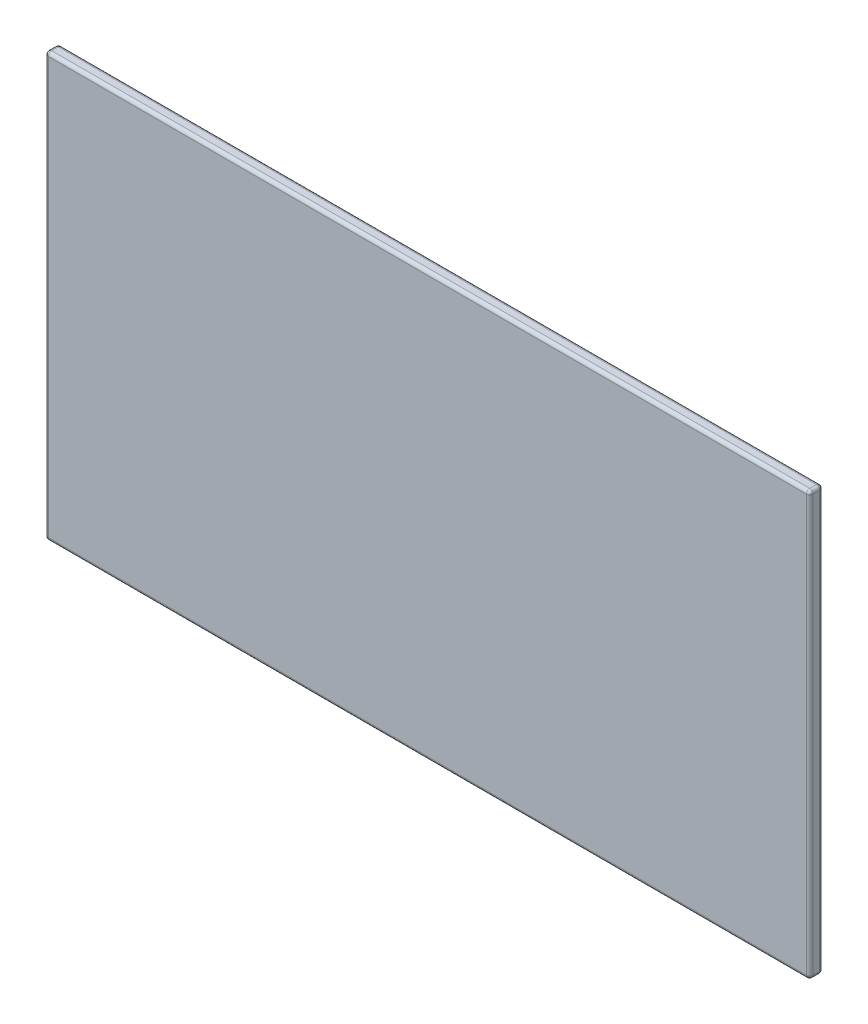
from build123d import *

# Parameters (mm, degrees)
SKETCH1_W           = 114.7
SKETCH1_H           = 63.5
BOSS_EXTRUDE1_DEPTH = 2
FILLET1_R           = 0.5


with BuildPart() as part:
    # Sketch1 → Boss-Extrude1 (new body)
    with BuildSketch(Plane.XY):
        Rectangle(SKETCH1_W, SKETCH1_H)
    extrude(amount=BOSS_EXTRUDE1_DEPTH)

    # Fillet1
    fillet1_edges = [part.edges().sort_by_distance(p)[0] for p in [
        (-57.35, 0, 2),
        (0, -31.75, 2),
        (57.35, 0, 2),
        (0, -31.75, 0),
        (-57.35, 0, 0),
        (0, 31.75, 0),
        (57.35, 0, 0),
        (57.35, -31.75, 1),
        (-57.35, -31.75, 1),
        (-57.35, 31.75, 1),
        (57.35, 31.75, 1),
        (0, 31.75, 2),
    ]]
    fillet(fillet1_edges, radius=FILLET1_R)


solid = part.part
